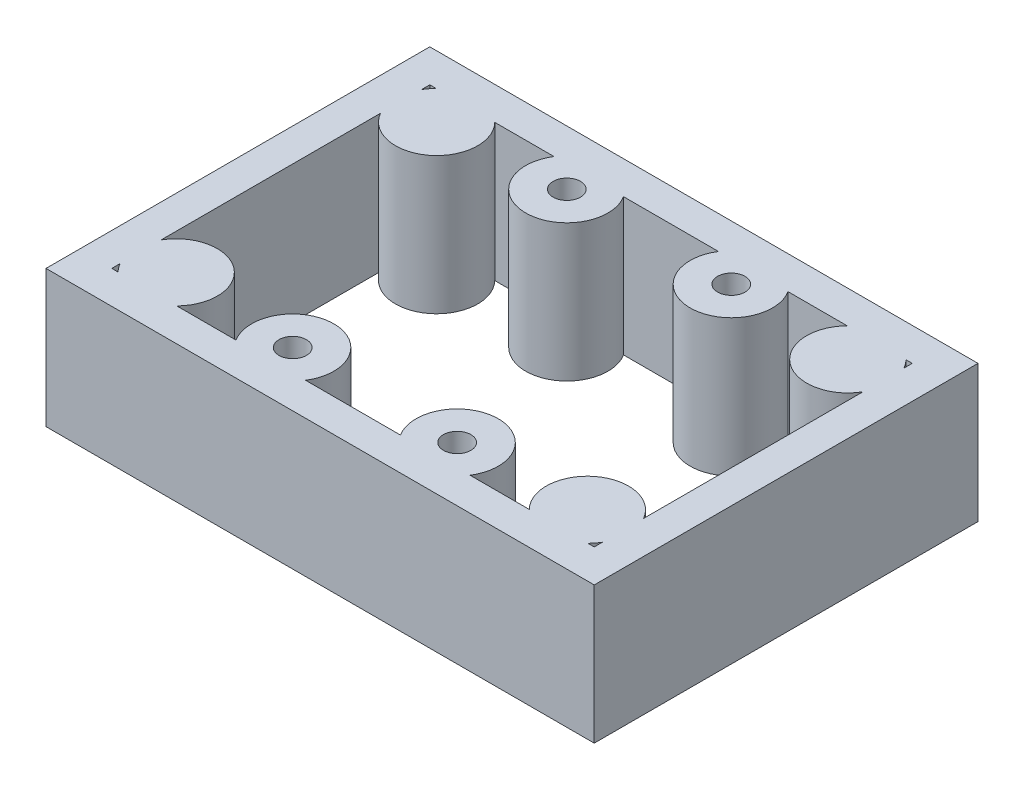
from build123d import *

# Parameters (mm, degrees)
BOSS_EXTRUDE1_START  = 46
SKETCH1_W            = 40
SKETCH1_H            = 10
BOSS_EXTRUDE1_DEPTH  = 28
BOSS_EXTRUDE2_START  = 48.4
SKETCH2_W            = 35.2
SKETCH2_H            = 12
BOSS_EXTRUDE2_DEPTH  = 23.2
BOSS_EXTRUDE3_START  = 50
SKETCH3_R            = 3
BOSS_EXTRUDE3_DEPTH  = 10
BOSS_EXTRUDE4_START  = 50
SKETCH4_R            = 3
BOSS_EXTRUDE4_DEPTH  = 10
BOSS_EXTRUDE5_START  = 50
SKETCH5_R            = 3
BOSS_EXTRUDE5_DEPTH  = 10
BOSS_EXTRUDE6_START  = 50
SKETCH6_R            = 3
BOSS_EXTRUDE6_DEPTH  = 10
BOSS_EXTRUDE7_START  = 50
SKETCH7_R            = 3
BOSS_EXTRUDE7_DEPTH  = 10
BOSS_EXTRUDE8_START  = 50
SKETCH8_R            = 3
BOSS_EXTRUDE8_DEPTH  = 10
BOSS_EXTRUDE9_START  = 50
SKETCH9_R            = 3
BOSS_EXTRUDE9_DEPTH  = 10
BOSS_EXTRUDE10_START = 50
SKETCH10_R           = 3
BOSS_EXTRUDE10_DEPTH = 10
BOSS_EXTRUDE11_START = 49
SKETCH11_R           = 1
BOSS_EXTRUDE11_DEPTH = 9.5
BOSS_EXTRUDE12_START = 49
SKETCH12_R           = 1
BOSS_EXTRUDE12_DEPTH = 9.5
BOSS_EXTRUDE13_START = 49
SKETCH13_R           = 1
BOSS_EXTRUDE13_DEPTH = 9.5
BOSS_EXTRUDE14_START = 49
SKETCH14_R           = 1
BOSS_EXTRUDE14_DEPTH = 9.5
BOSS_EXTRUDE15_START = 51.5
SKETCH15_R           = 1
BOSS_EXTRUDE15_DEPTH = 9.5
BOSS_EXTRUDE16_START = 51.5
SKETCH16_R           = 1
BOSS_EXTRUDE16_DEPTH = 9.5
BOSS_EXTRUDE17_START = 51.5
SKETCH17_R           = 1
BOSS_EXTRUDE17_DEPTH = 9.5
BOSS_EXTRUDE18_START = 51.5
SKETCH18_R           = 1
BOSS_EXTRUDE18_DEPTH = 9.5


with BuildPart() as part:
    # Sketch1 → Boss-Extrude1 (new body)
    with BuildSketch(Plane.XY.offset(BOSS_EXTRUDE1_START)):
        with Locations((0, 55)):
            Rectangle(SKETCH1_W, SKETCH1_H)
    extrude(amount=BOSS_EXTRUDE1_DEPTH)


with BuildPart() as body_2:
    # Sketch2 → Boss-Extrude2 (new body)
    with BuildSketch(Plane.XY.offset(BOSS_EXTRUDE2_START)):
        with Locations((0, 55)):
            Rectangle(SKETCH2_W, SKETCH2_H)
    extrude(amount=BOSS_EXTRUDE2_DEPTH)


with BuildPart() as part_1:
    add(part.part)

    # Combine1: cut body 2
    add(body_2.part, mode=Mode.SUBTRACT)

    # Sketch3 → Boss-Extrude3 (add)
    with BuildSketch(Plane(origin=(0, 0, 0), x_dir=(1, 0, 0), z_dir=(0, 1, 0)).offset(BOSS_EXTRUDE3_START)):
        with Locations((-15, -50.5)):
            Circle(SKETCH3_R)
    extrude(amount=BOSS_EXTRUDE3_DEPTH)

    # Sketch4 → Boss-Extrude4 (add)
    with BuildSketch(Plane(origin=(0, 0, 0), x_dir=(1, 0, 0), z_dir=(0, 1, 0)).offset(BOSS_EXTRUDE4_START)):
        with Locations((-15, -69.5)):
            Circle(SKETCH4_R)
    extrude(amount=BOSS_EXTRUDE4_DEPTH)

    # Sketch5 → Boss-Extrude5 (add)
    with BuildSketch(Plane(origin=(0, 0, 0), x_dir=(1, 0, 0), z_dir=(0, 1, 0)).offset(BOSS_EXTRUDE5_START)):
        with Locations((15, -50.5)):
            Circle(SKETCH5_R)
    extrude(amount=BOSS_EXTRUDE5_DEPTH)

    # Sketch6 → Boss-Extrude6 (add)
    with BuildSketch(Plane(origin=(0, 0, 0), x_dir=(1, 0, 0), z_dir=(0, 1, 0)).offset(BOSS_EXTRUDE6_START)):
        with Locations((15, -69.5)):
            Circle(SKETCH6_R)
    extrude(amount=BOSS_EXTRUDE6_DEPTH)

    # Sketch7 → Boss-Extrude7 (add)
    with BuildSketch(Plane(origin=(0, 0, 0), x_dir=(1, 0, 0), z_dir=(0, 1, 0)).offset(BOSS_EXTRUDE7_START)):
        with Locations((-6, -50)):
            Circle(SKETCH7_R)
    extrude(amount=BOSS_EXTRUDE7_DEPTH)

    # Sketch8 → Boss-Extrude8 (add)
    with BuildSketch(Plane(origin=(0, 0, 0), x_dir=(1, 0, 0), z_dir=(0, 1, 0)).offset(BOSS_EXTRUDE8_START)):
        with Locations((-6, -70)):
            Circle(SKETCH8_R)
    extrude(amount=BOSS_EXTRUDE8_DEPTH)

    # Sketch9 → Boss-Extrude9 (add)
    with BuildSketch(Plane(origin=(0, 0, 0), x_dir=(1, 0, 0), z_dir=(0, 1, 0)).offset(BOSS_EXTRUDE9_START)):
        with Locations((6, -50)):
            Circle(SKETCH9_R)
    extrude(amount=BOSS_EXTRUDE9_DEPTH)

    # Sketch10 → Boss-Extrude10 (add)
    with BuildSketch(Plane(origin=(0, 0, 0), x_dir=(1, 0, 0), z_dir=(0, 1, 0)).offset(BOSS_EXTRUDE10_START)):
        with Locations((6, -70)):
            Circle(SKETCH10_R)
    extrude(amount=BOSS_EXTRUDE10_DEPTH)


with BuildPart() as body_2_2:
    # Sketch11 → Boss-Extrude11 (new body)
    with BuildSketch(Plane(origin=(0, 0, 0), x_dir=(1, 0, 0), z_dir=(0, 1, 0)).offset(BOSS_EXTRUDE11_START)):
        with Locations(Location((-15, -50.5, 0), (0, 0, 270))):
            Circle(SKETCH11_R)
    extrude(amount=BOSS_EXTRUDE11_DEPTH)


with BuildPart() as part_2:
    add(part_1.part)

    # Combine2: cut body 2 2
    add(body_2_2.part, mode=Mode.SUBTRACT)


with BuildPart() as body_2_3:
    # Sketch12 → Boss-Extrude12 (new body)
    with BuildSketch(Plane(origin=(0, 0, 0), x_dir=(1, 0, 0), z_dir=(0, 1, 0)).offset(BOSS_EXTRUDE12_START)):
        with Locations(Location((-15, -69.5, 0), (0, 0, 270))):
            Circle(SKETCH12_R)
    extrude(amount=BOSS_EXTRUDE12_DEPTH)


with BuildPart() as part_3:
    add(part_2.part)

    # Combine3: cut body 2 3
    add(body_2_3.part, mode=Mode.SUBTRACT)


with BuildPart() as body_2_4:
    # Sketch13 → Boss-Extrude13 (new body)
    with BuildSketch(Plane(origin=(0, 0, 0), x_dir=(1, 0, 0), z_dir=(0, 1, 0)).offset(BOSS_EXTRUDE13_START)):
        with Locations(Location((15, -50.5, 0), (0, 0, 270))):
            Circle(SKETCH13_R)
    extrude(amount=BOSS_EXTRUDE13_DEPTH)


with BuildPart() as part_4:
    add(part_3.part)

    # Combine4: cut body 2 4
    add(body_2_4.part, mode=Mode.SUBTRACT)


with BuildPart() as body_2_5:
    # Sketch14 → Boss-Extrude14 (new body)
    with BuildSketch(Plane(origin=(0, 0, 0), x_dir=(1, 0, 0), z_dir=(0, 1, 0)).offset(BOSS_EXTRUDE14_START)):
        with Locations(Location((15, -69.5, 0), (0, 0, 270))):
            Circle(SKETCH14_R)
    extrude(amount=BOSS_EXTRUDE14_DEPTH)


with BuildPart() as part_5:
    add(part_4.part)

    # Combine5: cut body 2 5
    add(body_2_5.part, mode=Mode.SUBTRACT)


with BuildPart() as body_2_6:
    # Sketch15 → Boss-Extrude15 (new body)
    with BuildSketch(Plane(origin=(0, 0, 0), x_dir=(1, 0, 0), z_dir=(0, 1, 0)).offset(BOSS_EXTRUDE15_START)):
        with Locations(Location((-6, -50, 0), (0, 0, 270))):
            Circle(SKETCH15_R)
    extrude(amount=BOSS_EXTRUDE15_DEPTH)


with BuildPart() as part_6:
    add(part_5.part)

    # Combine6: cut body 2 6
    add(body_2_6.part, mode=Mode.SUBTRACT)


with BuildPart() as body_2_7:
    # Sketch16 → Boss-Extrude16 (new body)
    with BuildSketch(Plane(origin=(0, 0, 0), x_dir=(1, 0, 0), z_dir=(0, 1, 0)).offset(BOSS_EXTRUDE16_START)):
        with Locations(Location((-6, -70, 0), (0, 0, 270))):
            Circle(SKETCH16_R)
    extrude(amount=BOSS_EXTRUDE16_DEPTH)


with BuildPart() as part_7:
    add(part_6.part)

    # Combine7: cut body 2 7
    add(body_2_7.part, mode=Mode.SUBTRACT)


with BuildPart() as body_2_8:
    # Sketch17 → Boss-Extrude17 (new body)
    with BuildSketch(Plane(origin=(0, 0, 0), x_dir=(1, 0, 0), z_dir=(0, 1, 0)).offset(BOSS_EXTRUDE17_START)):
        with Locations(Location((6, -50, 0), (0, 0, 270))):
            Circle(SKETCH17_R)
    extrude(amount=BOSS_EXTRUDE17_DEPTH)


with BuildPart() as part_8:
    add(part_7.part)

    # Combine8: cut body 2 8
    add(body_2_8.part, mode=Mode.SUBTRACT)


with BuildPart() as body_2_9:
    # Sketch18 → Boss-Extrude18 (new body)
    with BuildSketch(Plane(origin=(0, 0, 0), x_dir=(1, 0, 0), z_dir=(0, 1, 0)).offset(BOSS_EXTRUDE18_START)):
        with Locations(Location((6, -70, 0), (0, 0, 270))):
            Circle(SKETCH18_R)
    extrude(amount=BOSS_EXTRUDE18_DEPTH)


with BuildPart() as part_9:
    add(part_8.part)

    # Combine9: cut body 2 9
    add(body_2_9.part, mode=Mode.SUBTRACT)


solid = part_9.part
